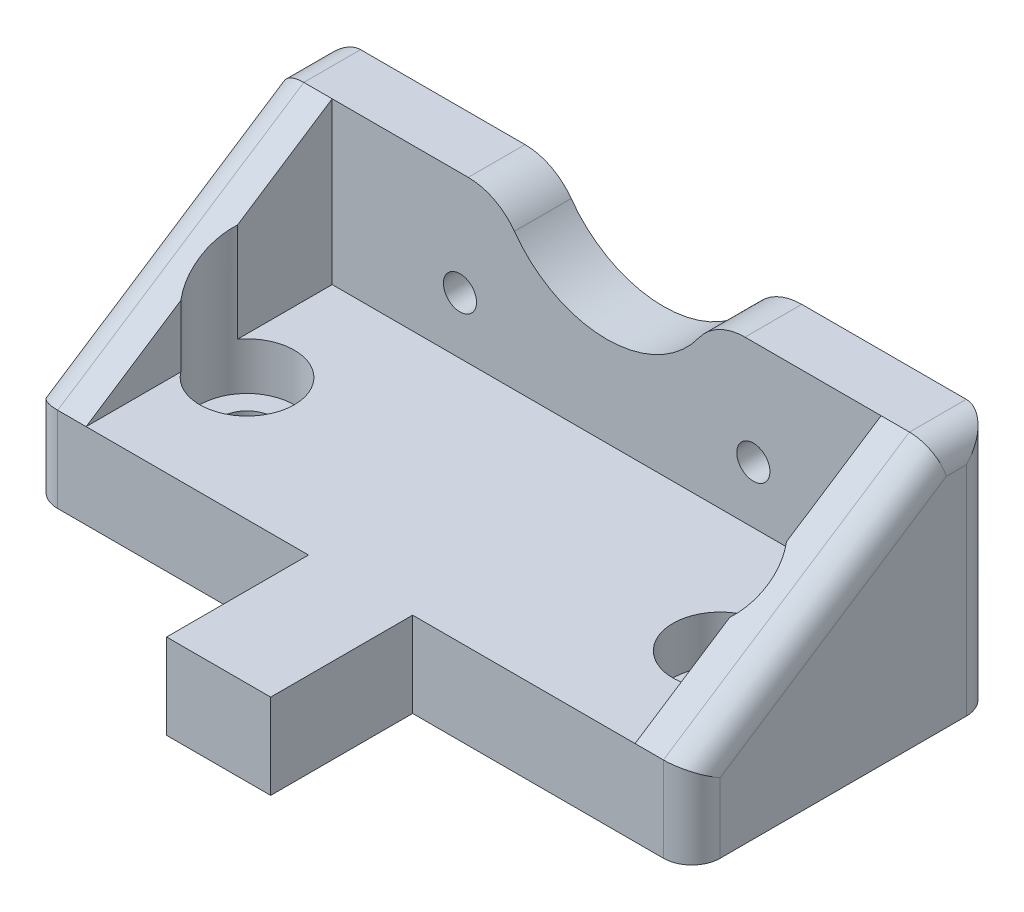
from build123d import *

# Parameters (mm, degrees)
BOSS_EXTRUDE1_DEPTH = 9
BOSS_EXTRUDE2_DEPTH = 6
BOSS_EXTRUDE3_DEPTH = 6
SKETCH4_R           = 2.75
CUT_EXTRUDE1_DEPTH  = 50.749371855
CUT_EXTRUDE2_START  = -5
SKETCH5_R           = 5
CUT_EXTRUDE2_DEPTH  = 55.749371855
SKETCH6_R           = 1.75
CUT_EXTRUDE3_DEPTH  = 60.84981203
FILLET1_R           = 3


with BuildPart() as part:
    # Sketch1 → Boss-Extrude1 (new body)
    with BuildSketch(Plane(origin=(0, 0, 0), x_dir=(1, 0, 0), z_dir=(0, 1, 0))):
        Polygon((5.5, -16), (35, -16), (35, 16), (-35, 16), (-35, -16), (-5.5, -16), (-5.5, -31), (5.5, -31), align=None)
    extrude(amount=BOSS_EXTRUDE1_DEPTH)

    # Sketch2 → Boss-Extrude2 (add)
    with BuildSketch(Plane(origin=(0, 0, -16), x_dir=(-1, 0, 0), z_dir=(0, 0, -1))):
        with BuildLine():
            Line((-35, 9), (35, 9))
            Line((35, 9), (35, 26))
            Line((35, 26), (14.620191517, 26))
            ThreePointArc((14.620191517, 26), (11.88157873, 25.338539126), (9.746794345, 23.5))
            ThreePointArc((9.746794345, 23.5), (0, 18.5), (-9.746794345, 23.5))
            ThreePointArc((-9.746794345, 23.5), (-11.88157873, 25.338539126), (-14.620191517, 26))
            Line((-14.620191517, 26), (-35, 26))
            Line((-35, 26), (-35, 9))
        make_face()
    extrude(amount=-BOSS_EXTRUDE2_DEPTH)

    # Sketch3 → Boss-Extrude3 (add)
    with BuildSketch(Plane(origin=(35, 0, 0), x_dir=(0, 0, -1), z_dir=(1, 0, 0))):
        Polygon((-16, 9), (10, 26), (10, 9), align=None)
    boss_extrude3 = extrude(amount=-BOSS_EXTRUDE3_DEPTH)

    # Sketch4 → Cut-Extrude1 (cut, through all)
    with BuildSketch(Plane(origin=(0, 9, 0), x_dir=(1, 0, 0), z_dir=(0, 1, 0))):
        with Locations(Location((25, -3, 0), (0, 0, 270))):
            Circle(SKETCH4_R)
    cut_extrude1 = extrude(amount=-CUT_EXTRUDE1_DEPTH, mode=Mode.SUBTRACT)

    # Sketch5 → Cut-Extrude2 (cut)
    with BuildSketch(Plane(origin=(0, 9, 0), x_dir=(1, 0, 0), z_dir=(0, 1, 0)).offset(CUT_EXTRUDE2_START)):
        with Locations(Location((25, -3, 0), (0, 0, 36.869897646))):
            Circle(SKETCH5_R)
    cut_extrude2 = extrude(amount=CUT_EXTRUDE2_DEPTH, mode=Mode.SUBTRACT)

    # Sketch6 → Cut-Extrude3 (cut, through all)
    with BuildSketch(Plane.XY.offset(-10)):
        with Locations((15.5, 15)):
            Circle(SKETCH6_R)
    cut_extrude3 = extrude(amount=-CUT_EXTRUDE3_DEPTH, mode=Mode.SUBTRACT)

    # Mirror1: Boss-Extrude3, Cut-Extrude1, Cut-Extrude2, Cut-Extrude3 across plane
    add(boss_extrude3.mirror(Plane(origin=(0, 0, 0), x_dir=(0, 0, 1), z_dir=(1, 0, 0))))
    add(cut_extrude1.mirror(Plane(origin=(0, 0, 0), x_dir=(0, 0, 1), z_dir=(1, 0, 0))), mode=Mode.SUBTRACT)
    add(cut_extrude2.mirror(Plane(origin=(0, 0, 0), x_dir=(0, 0, 1), z_dir=(1, 0, 0))), mode=Mode.SUBTRACT)
    add(cut_extrude3.mirror(Plane(origin=(0, 0, 0), x_dir=(0, 0, 1), z_dir=(1, 0, 0))), mode=Mode.SUBTRACT)

    # Fillet1
    fillet1_edges = [part.edges().sort_by_distance(p)[0] for p in [
        (35, 4.5, 16),
        (-35, 4.5, 16),
        (-35, 13, -16),
        (35, 13, -16),
        (35, 26, -13),
        (-35, 26, -13),
        (35, 17.5, 3),
        (-35, 17.5, 3),
    ]]
    fillet(fillet1_edges, radius=FILLET1_R)


solid = part.part
